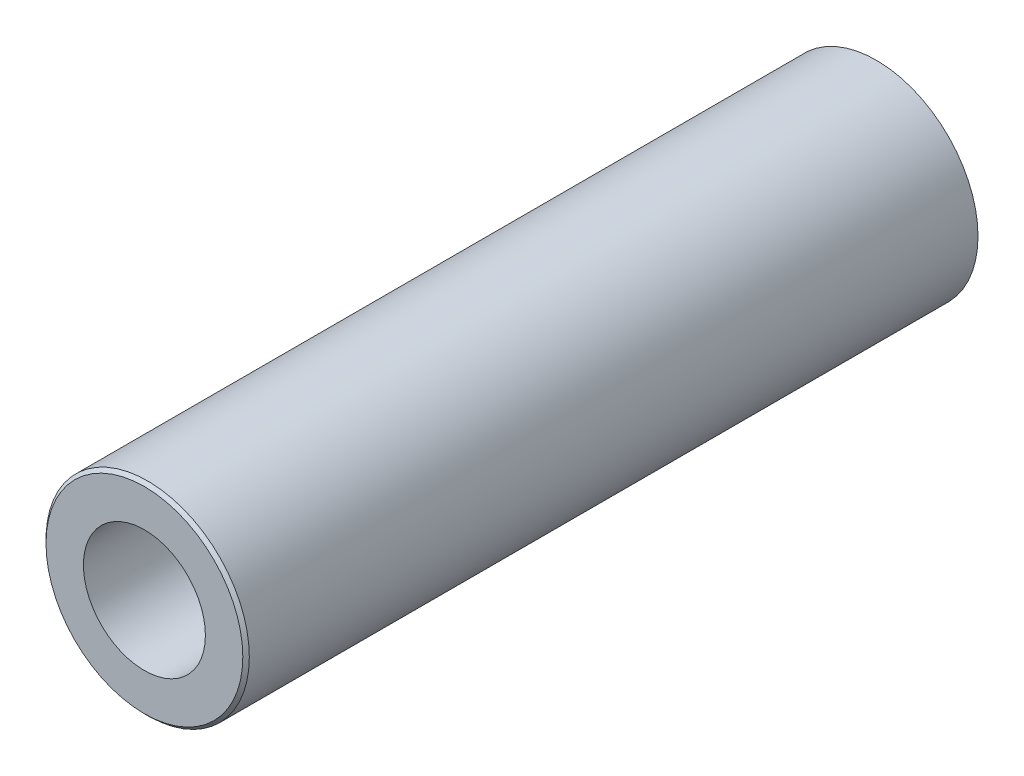
from build123d import *

# Parameters (mm, degrees)
SKETCH1_R                   = 7.9375
BOSS_EXTRUDE1_DEPTH         = 57.15
CHAMFER1_SIZE               = 0.254
F_5_16_0_3125_DOWEL_HOLE1_D = 9.525


with BuildPart() as part:
    # Sketch1 → Boss-Extrude1 (new body)
    with BuildSketch(Plane.XY):
        Circle(SKETCH1_R)
    extrude(amount=BOSS_EXTRUDE1_DEPTH)

    # Chamfer1
    chamfer1_edges = [part.edges().sort_by_distance(p)[0] for p in [
        (-7.9375, 0, 57.15),
    ]]
    chamfer(chamfer1_edges, length=CHAMFER1_SIZE)

    # 5/16 (0.3125) Dowel Hole1 (through all)
    with Locations(Plane.XY.offset(57.15)):
        with Locations((0, 0)):
            Hole(F_5_16_0_3125_DOWEL_HOLE1_D / 2)


solid = part.part
